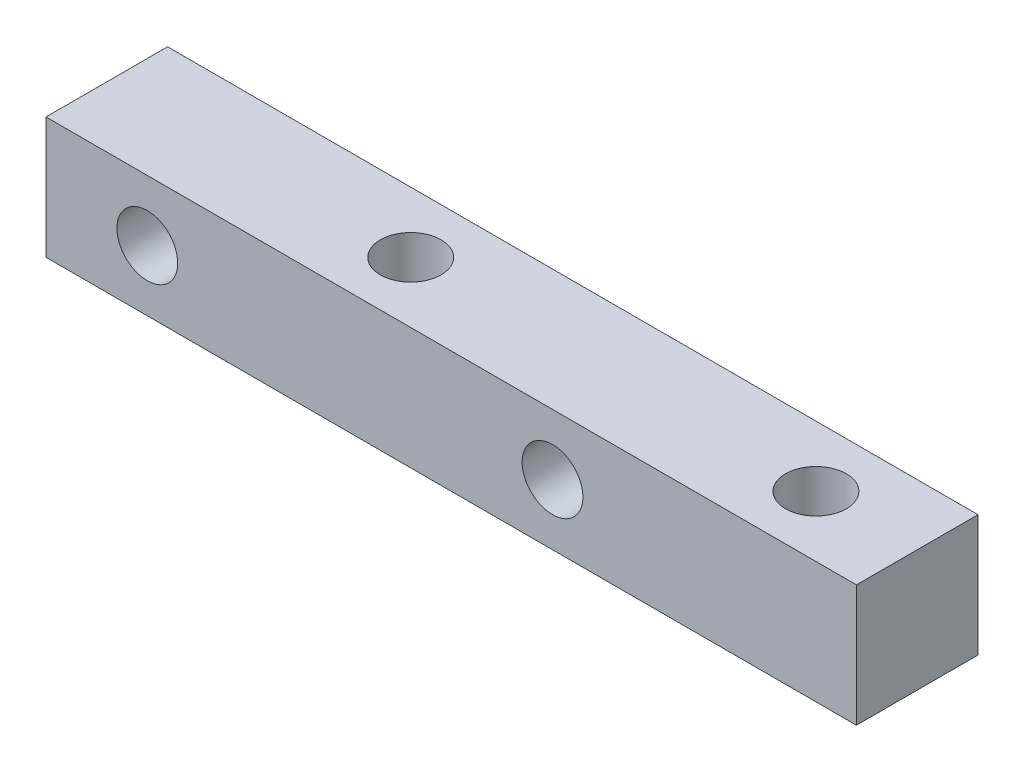
from build123d import *

# Parameters (mm, degrees)
SKETCH_1_W          = 40
SKETCH_1_H          = 6
SKETCH_1_R          = 1.5
EXTRUDE_1_DEPTH     = 6
SKETCH_2_R          = 1.5
CUT_EXTRUDE_1_DEPTH = 6


with BuildPart() as part:
    # 草图1 → 凸台-拉伸1 (new body)
    with BuildSketch(Plane.XY):
        with Locations((20, 3)):
            Rectangle(SKETCH_1_W, SKETCH_1_H)
        with Locations((5, 3)):
            Circle(SKETCH_1_R, mode=Mode.SUBTRACT)
        with Locations((25, 3)):
            Circle(SKETCH_1_R, mode=Mode.SUBTRACT)
    extrude(amount=EXTRUDE_1_DEPTH)

    # 草图2 → 切除-拉伸1 (cut)
    with BuildSketch(Plane(origin=(0, 6, 0), x_dir=(1, 0, 0), z_dir=(0, 1, 0))):
        with Locations(Location((15, -3, 0), (0, 0, 270))):
            Circle(SKETCH_2_R)
        with Locations(Location((35, -3, 0), (0, 0, 270))):
            Circle(SKETCH_2_R)
    extrude(amount=-CUT_EXTRUDE_1_DEPTH, mode=Mode.SUBTRACT)


solid = part.part
